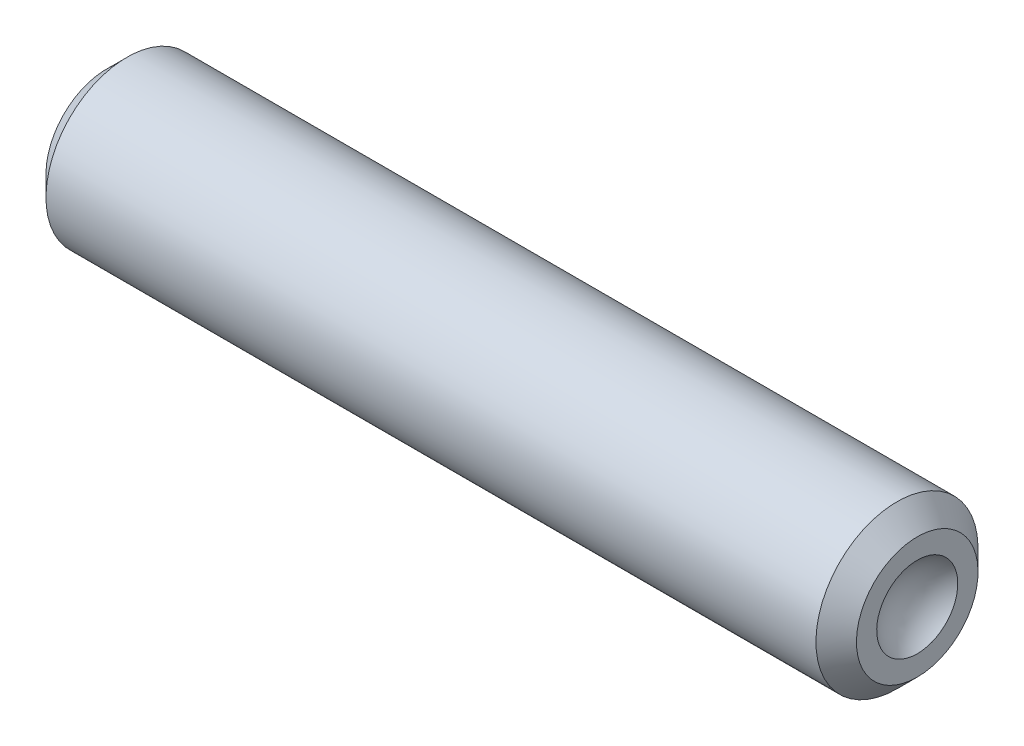
from build123d import *

# Parameters (mm, degrees)
CUT_EXTRUDE1_DEPTH = 18


with BuildPart() as part:
    # Sketch1 → Revolve1 (revolve)
    with BuildSketch(Plane.XY, mode=Mode.PRIVATE) as revolve1_sk:
        with BuildLine():
            Line((0, 0), (0, 1.5))
            Line((0, 1.5), (0.5, 2))
            Line((0.5, 2), (19.5, 2))
            Line((19.5, 2), (20, 1.5))
            Line((20, 1.5), (20, 1))
            ThreePointArc((20, 1), (19.631966011, 0.559016994), (19.5, 0))
            Line((19.5, 0), (0, 0))
        make_face()
    revolve(revolve1_sk.sketch.rotate(Axis((0, 0, 0), (1, 0, 0)), 180), axis=Axis((0, 0, 0), (1, 0, 0)))

    # Sketch2 → Cut-Extrude1 (cut)
    with BuildSketch(Plane.ZY):
        Polygon((0, 1.154700538), (-1, 0.577350269), (-1, -0.577350269), (0, -1.154700538), (1, -0.577350269), (1, 0.577350269), align=None)
    extrude(amount=-CUT_EXTRUDE1_DEPTH, mode=Mode.SUBTRACT)


solid = part.part
